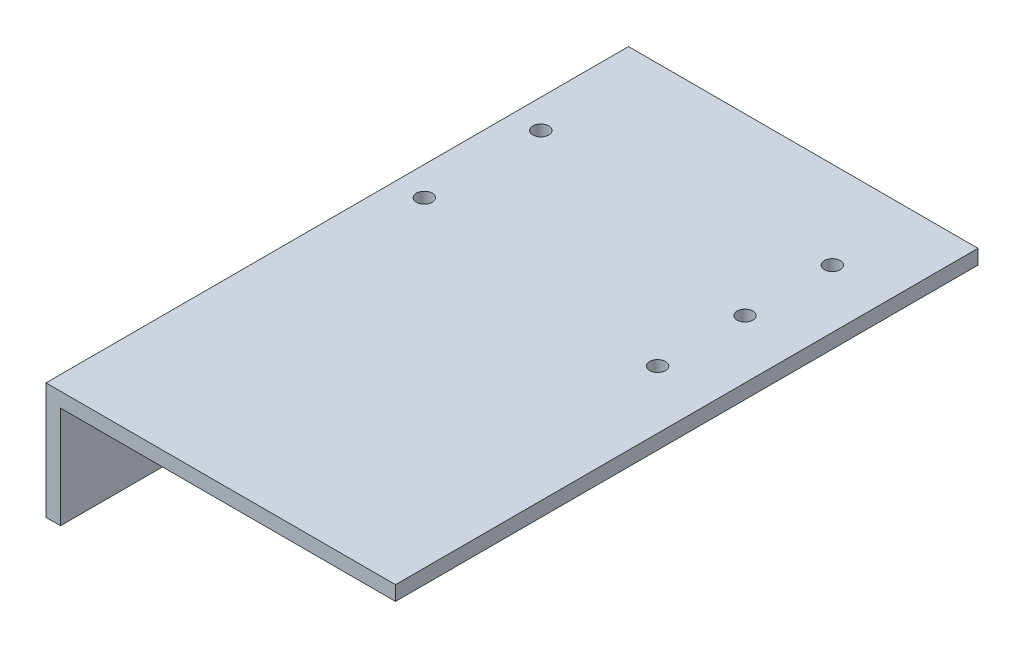
from build123d import *

# Parameters (mm, degrees)
BOSS_EXTRUDE1_DEPTH       = 76.2
TAP_DRILL_FOR_6_32_TAP1_D = 2.7051
TAP_DRILL_FOR_8_32_TAP1_D = 3.4544
CUT_EXTRUDE1_REACH        = 112.716
SKETCH8_W                 = 3.302
SKETCH8_H                 = 3.302
TAP_DRILL_FOR_8_32_TAP2_D = 3.4544
BOSS_EXTRUDE2_DEPTH       = 50.8


with BuildPart() as part:
    # Sketch2 → Boss-Extrude1 (new body)
    with BuildSketch(Plane.XY):
        Polygon((0, 0), (-76.2, 0), (-76.2, -25.4), (-73.025, -25.4), (-73.025, -3.175), (0, -3.175), align=None)
    extrude(amount=BOSS_EXTRUDE1_DEPTH)

    # Tap Drill for #6-32 Tap1 (through all)
    with Locations(Plane.ZY.offset(76.2)):
        with Locations((25.4, -15.24), (12.7, -15.24)):
            Hole(TAP_DRILL_FOR_6_32_TAP1_D / 2)

    # Tap Drill for #8-32 Tap1 (through all)
    with Locations(Plane(origin=(0, 0, 0), x_dir=(1, 0, 0), z_dir=(0, 1, 0))):
        with Locations((-69.917738612, -25.4), (-69.917738612, -50.8)):
            Hole(TAP_DRILL_FOR_8_32_TAP1_D / 2)

    # Sketch8 → Cut-Extrude1 (cut, up to next)
    with BuildSketch(Plane.ZY.offset(76.2), mode=Mode.PRIVATE) as cut_extrude1_sk1:
        with Locations((38.1, -15.24)):
            Rectangle(SKETCH8_W, SKETCH8_H)
    cut_extrude1_tool1 = extrude(cut_extrude1_sk1.sketch, amount=-CUT_EXTRUDE1_REACH, mode=Mode.PRIVATE) & part.part
    add(cut_extrude1_tool1.solids().sort_by_distance((-76.2, -15.24, 38.1))[0], mode=Mode.SUBTRACT)

    # Tap Drill for #8-32 Tap2 (through all)
    with Locations(Plane(origin=(0, 0, 0), x_dir=(1, 0, 0), z_dir=(0, 1, 0))):
        with Locations((-12.7, -19.05), (-12.7, -38.1), (-12.7, -57.15)):
            Hole(TAP_DRILL_FOR_8_32_TAP2_D / 2)

    # Sketch11 → Boss-Extrude2 (add)
    with BuildSketch(Plane.XY.offset(76.2)):
        Polygon((-76.2, 0), (-76.2, -25.4), (-73.025, -25.4), (-73.025, -3.175), (0, -3.175), (0, 0), align=None)
    extrude(amount=BOSS_EXTRUDE2_DEPTH)


solid = part.part
